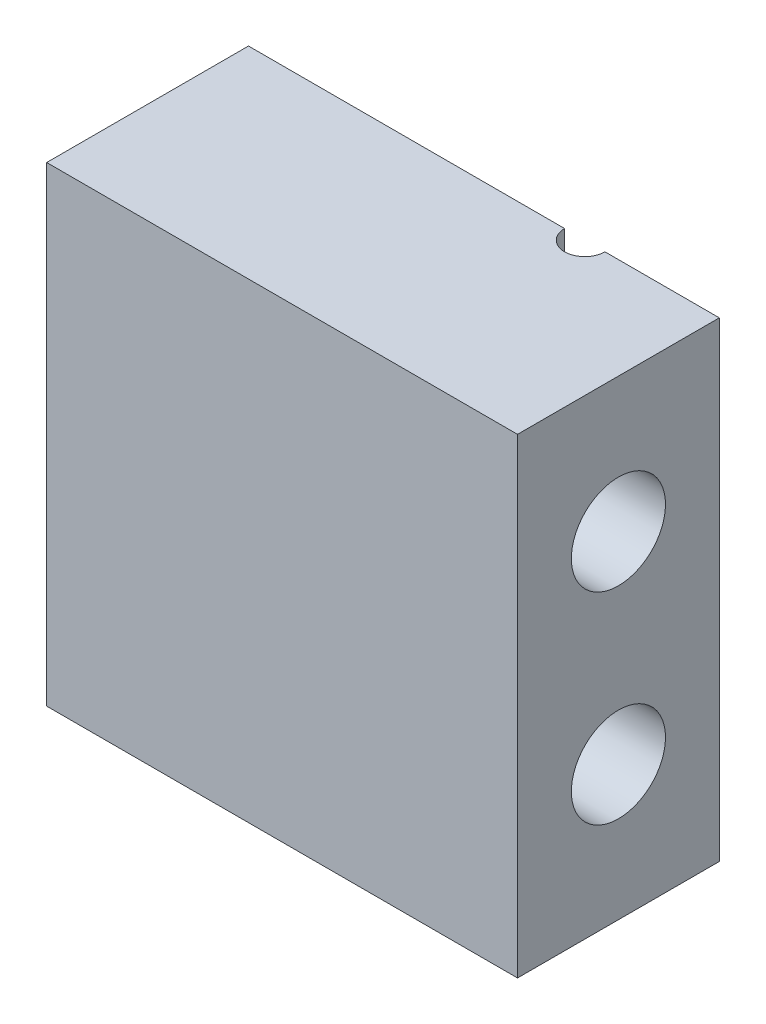
from build123d import *

# Parameters (mm, degrees)
BOSS_EXTRUDE1_DEPTH                 = 8.89
F_2_56_TAPPED_HOLE1_D               = 1.778
F_2_56_TAPPED_HOLE1_DEPTH           = 2.54
F_2_56_TAPPED_HOLE1_TIP             = 0.53416509
F_2_56_TAPPED_HOLE1_ON_FACE_2_D     = 1.778
F_2_56_TAPPED_HOLE1_ON_FACE_2_DEPTH = 2.54
F_2_56_TAPPED_HOLE1_ON_FACE_2_TIP   = 0.53416509


with BuildPart() as part:
    # Sketch1 → Boss-Extrude1 (new body)
    with BuildSketch(Plane(origin=(0, 0, 0), x_dir=(1, 0, 0), z_dir=(0, 1, 0))):
        with BuildLine():
            Line((6.731, 3.81), (8.89, 3.81))
            Line((8.89, 3.81), (8.89, 0))
            Line((8.89, 0), (0, 0))
            Line((0, 0), (0, 3.81))
            Line((0, 3.81), (5.969, 3.81))
            ThreePointArc((5.969, 3.81), (6.35, 3.429), (6.731, 3.81))
        make_face()
    extrude(amount=BOSS_EXTRUDE1_DEPTH)

    # #2-56 Tapped Hole1
    with Locations(Plane(origin=(8.89, 2.54, -1.905), x_dir=(0, 0, 1), z_dir=(1, 0, 0))):
        with Locations((0, 0), (0, -3.81)):
            Hole(F_2_56_TAPPED_HOLE1_D / 2, depth=F_2_56_TAPPED_HOLE1_DEPTH)
            with Locations((0, 0, -(F_2_56_TAPPED_HOLE1_DEPTH + F_2_56_TAPPED_HOLE1_TIP / 2))):  # 118° drill point
                Cone(0, F_2_56_TAPPED_HOLE1_D / 2, F_2_56_TAPPED_HOLE1_TIP, mode=Mode.SUBTRACT)

    # #2-56 Tapped Hole1 on face 2
    with Locations(Plane(origin=(2.032, 2.54, -3.81), x_dir=(-1, 0, 0), z_dir=(0, 0, -1))):
        with Locations((0, 0), (0, 3.81)):
            Hole(F_2_56_TAPPED_HOLE1_ON_FACE_2_D / 2, depth=F_2_56_TAPPED_HOLE1_ON_FACE_2_DEPTH)
            with Locations((0, 0, -(F_2_56_TAPPED_HOLE1_ON_FACE_2_DEPTH + F_2_56_TAPPED_HOLE1_ON_FACE_2_TIP / 2))):  # 118° drill point
                Cone(0, F_2_56_TAPPED_HOLE1_ON_FACE_2_D / 2, F_2_56_TAPPED_HOLE1_ON_FACE_2_TIP, mode=Mode.SUBTRACT)


solid = part.part
